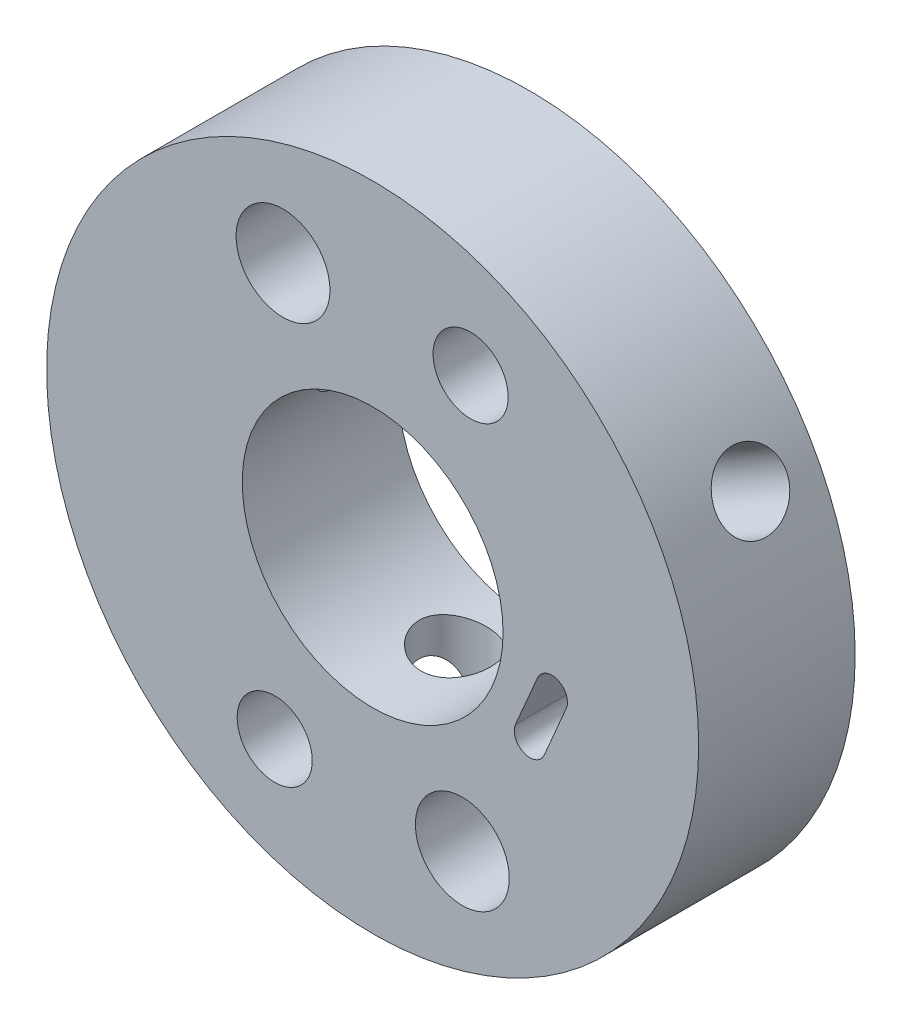
from build123d import *

# Parameters (mm, degrees)
SKETCH1_R                                      = 15.875
BOSS_EXTRUDE1_DEPTH                            = 7.62
SKETCH2_R                                      = 6.35
CUT_EXTRUDE1_DEPTH                             = 24.708556472
CIRPATTERN1_COUNT                              = 3
CBORE_FOR_6_SOCKET_HEAD_CAP_SCREW1_D           = 3.6576
CBORE_FOR_6_SOCKET_HEAD_CAP_SCREW1_CBORE_D     = 7.14502
CBORE_FOR_6_SOCKET_HEAD_CAP_SCREW1_CBORE_DEPTH = 3.5052
CIRPATTERN2_COUNT                              = 2
SKETCH42_R                                     = 2.286
CUT_EXTRUDE2_DEPTH                             = 7.62
CIRPATTERN3_COUNT                              = 2
CUT_EXTRUDE3_DEPTH                             = 24.70855664


with BuildPart() as part:
    # Sketch1 → Boss-Extrude1 (new body)
    with BuildSketch(Plane.XY):
        with Locations(Location((0, 0, 0), (0, 0, 180))):
            Circle(SKETCH1_R)
    extrude(amount=BOSS_EXTRUDE1_DEPTH)

    # Sketch2 → Cut-Extrude1 (cut, through all)
    with BuildSketch(Plane.XY.offset(7.62)):
        Circle(SKETCH2_R)
    extrude(amount=-CUT_EXTRUDE1_DEPTH, mode=Mode.SUBTRACT)

    # Sketch36 → Tap Drill for #8-32 Tap1 (revolve, cut)
    with BuildSketch(Plane(origin=(-0.450397279, -15.875, 3.175), x_dir=(0, 0, -1), z_dir=(1, 0, 0))):
        Polygon((0, 0), (0, 20.499292883), (1.7272, 19.05), (1.7272, 0), align=None)
    tap_drill_for_8_32_tap1 = revolve(axis=Axis((-0.450397279, -22.225, 3.175), (0, 1, 0)), mode=Mode.SUBTRACT)

    # CirPattern1: Tap Drill for #8-32 Tap1 ×3 about axis
    cirpattern1_axis = Axis((0, 0, 7.62), (0, 0, -1))
    for i in range(1, CIRPATTERN1_COUNT):
        add(tap_drill_for_8_32_tap1.rotate(cirpattern1_axis, i * 360 / CIRPATTERN1_COUNT), mode=Mode.SUBTRACT)

    # CBORE for #6 Socket Head Cap Screw1 (through all)
    with Locations(Plane(origin=(0, 0, 0), x_dir=(-1, 0, 0), z_dir=(0, 0, -1))):
        with Locations((4.769587089, -10.050926029)):
            cbore_for_6_socket_head_cap_screw1 = CounterBoreHole(CBORE_FOR_6_SOCKET_HEAD_CAP_SCREW1_D / 2, CBORE_FOR_6_SOCKET_HEAD_CAP_SCREW1_CBORE_D / 2, CBORE_FOR_6_SOCKET_HEAD_CAP_SCREW1_CBORE_DEPTH)

    # CirPattern2: CBORE for #6 Socket Head Cap Screw1 ×2 about axis
    cirpattern2_axis = Axis((0, 0, 0), (0, 0, 1))
    for i in range(1, CIRPATTERN2_COUNT):
        add(cbore_for_6_socket_head_cap_screw1.rotate(cirpattern2_axis, i * 360 / CIRPATTERN2_COUNT), mode=Mode.SUBTRACT)

    # Sketch42 → Cut-Extrude2 (cut)
    with BuildSketch(Plane(origin=(0, 0, 0), x_dir=(-1, 0, 0), z_dir=(0, 0, -1))):
        with Locations((4.365368762, 10.219159056)):
            Circle(SKETCH42_R)
    cut_extrude2 = extrude(amount=-CUT_EXTRUDE2_DEPTH, mode=Mode.SUBTRACT)

    # CirPattern3: Cut-Extrude2 ×2 about axis
    cirpattern3_axis = Axis((0, 0, 0), (0, 0, 1))
    for i in range(1, CIRPATTERN3_COUNT):
        add(cut_extrude2.rotate(cirpattern3_axis, i * 360 / CIRPATTERN3_COUNT), mode=Mode.SUBTRACT)

    # Sketch43 → Cut-Extrude3 (cut, through all)
    with BuildSketch(Plane(origin=(0, 0, 0), x_dir=(-1, 0, 0), z_dir=(0, 0, -1))):
        with BuildLine():
            Line((-8.025711128, -1.073137194), (-6.956985206, -3.563699487))
            ThreePointArc((-6.956985206, -3.563699487), (-7.355887027, -4.562271884), (-8.354459424, -4.163370063))
            Line((-8.354459424, -4.163370063), (-9.423185347, -1.67280777))
            ThreePointArc((-9.423185347, -1.67280777), (-9.024283525, -0.674235373), (-8.025711128, -1.073137194))
        make_face()
    extrude(amount=-CUT_EXTRUDE3_DEPTH, mode=Mode.SUBTRACT)


solid = part.part
